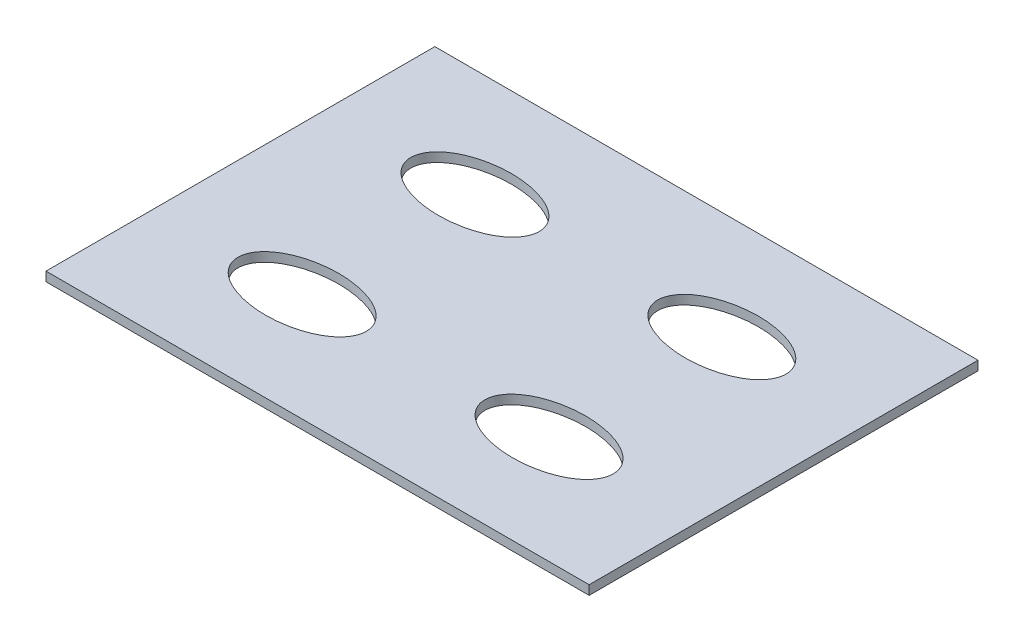
from build123d import *

# Parameters (mm, degrees)
SKETCH1_W           = 44
SKETCH1_H           = 31.5
BOSS_EXTRUDE1_DEPTH = 0.75


with BuildPart() as part:
    # Sketch1 → Boss-Extrude1 (new body)
    with BuildSketch(Plane(origin=(0, 0, 0), x_dir=(1, 0, 0), z_dir=(0, 1, 0))):
        Rectangle(SKETCH1_W, SKETCH1_H)
        with BuildLine():
            add(Edge.make_bspline(
                [(-15.2, -7), (-15.2, -7.404997748), (-14.900516049, -8.214993245), (-13.330687177, -9.496620347), (-10, -10.252253102), (-6.669312823, -9.496620347), (-5.099483951, -8.214993245), (-4.650258024, -7), (-5.099483951, -5.785006755), (-6.669312823, -4.503379653), (-10, -3.747746898), (-13.330687177, -4.503379653), (-14.900516049, -5.785006755), (-15.2, -6.595002252), (-15.2, -7)],
                knots=[0, 0, 0, 0, 0.392699082, 0.785398163, 1.570796327, 2.35619449, 2.748893572, 3.141592654, 3.534291735, 3.926990817, 4.71238898, 5.497787144, 5.890486225, 6.283185307, 6.283185307, 6.283185307, 6.283185307], degree=3))
        make_face(mode=Mode.SUBTRACT)
        with BuildLine():
            add(Edge.make_bspline(
                [(4.8, -7), (4.8, -7.404997748), (5.099483951, -8.214993245), (6.669312823, -9.496620347), (10, -10.252253102), (13.330687177, -9.496620347), (14.900516049, -8.214993245), (15.349741976, -7), (14.900516049, -5.785006755), (13.330687177, -4.503379653), (10, -3.747746898), (6.669312823, -4.503379653), (5.099483951, -5.785006755), (4.8, -6.595002252), (4.8, -7)],
                knots=[0, 0, 0, 0, 0.392699082, 0.785398163, 1.570796327, 2.35619449, 2.748893572, 3.141592654, 3.534291735, 3.926990817, 4.71238898, 5.497787144, 5.890486225, 6.283185307, 6.283185307, 6.283185307, 6.283185307], degree=3))
        make_face(mode=Mode.SUBTRACT)
        with BuildLine():
            add(Edge.make_bspline(
                [(4.8, 7), (4.8, 6.595002252), (5.099483951, 5.785006755), (6.669312823, 4.503379653), (10, 3.747746898), (13.330687177, 4.503379653), (14.900516049, 5.785006755), (15.349741976, 7), (14.900516049, 8.214993245), (13.330687177, 9.496620347), (10, 10.252253102), (6.669312823, 9.496620347), (5.099483951, 8.214993245), (4.8, 7.404997748), (4.8, 7)],
                knots=[0, 0, 0, 0, 0.392699082, 0.785398163, 1.570796327, 2.35619449, 2.748893572, 3.141592654, 3.534291735, 3.926990817, 4.71238898, 5.497787144, 5.890486225, 6.283185307, 6.283185307, 6.283185307, 6.283185307], degree=3))
        make_face(mode=Mode.SUBTRACT)
        with BuildLine():
            add(Edge.make_bspline(
                [(-15.2, 7), (-15.2, 6.595002252), (-14.900516049, 5.785006755), (-13.330687177, 4.503379653), (-10, 3.747746898), (-6.669312823, 4.503379653), (-5.099483951, 5.785006755), (-4.650258024, 7), (-5.099483951, 8.214993245), (-6.669312823, 9.496620347), (-10, 10.252253102), (-13.330687177, 9.496620347), (-14.900516049, 8.214993245), (-15.2, 7.404997748), (-15.2, 7)],
                knots=[0, 0, 0, 0, 0.392699082, 0.785398163, 1.570796327, 2.35619449, 2.748893572, 3.141592654, 3.534291735, 3.926990817, 4.71238898, 5.497787144, 5.890486225, 6.283185307, 6.283185307, 6.283185307, 6.283185307], degree=3))
        make_face(mode=Mode.SUBTRACT)
    extrude(amount=BOSS_EXTRUDE1_DEPTH)


solid = part.part
